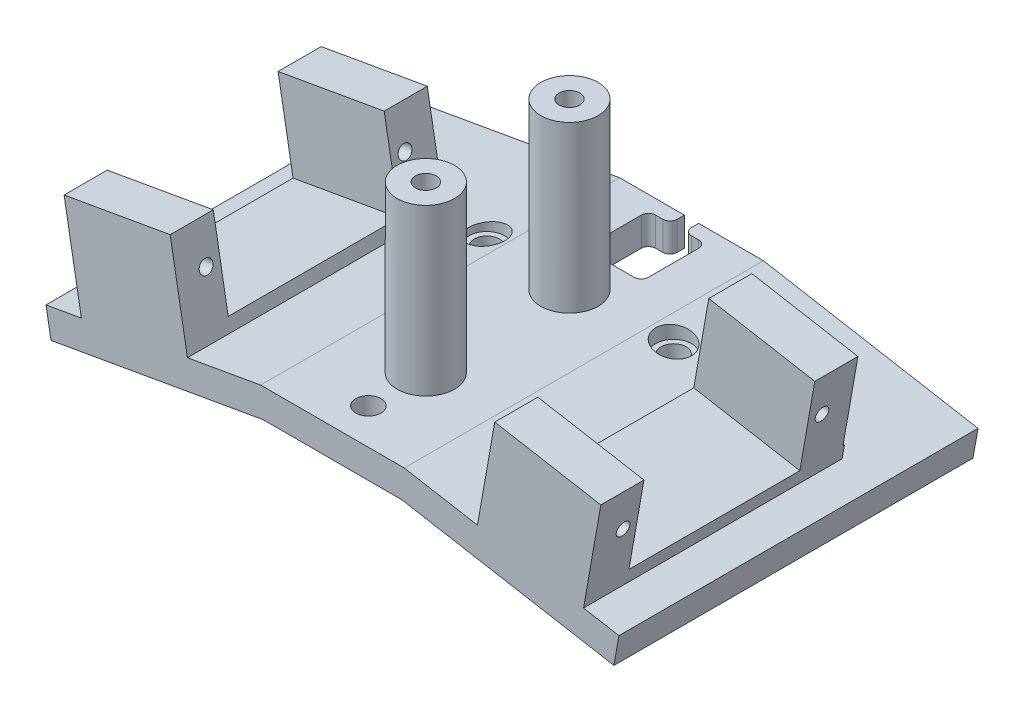
from build123d import *

# Parameters (mm, degrees)
EXTRUDE_1_DEPTH     = 25
EXTRUDE_2_DEPTH     = 36
SKETCH_3_W          = 15
SKETCH_3_H          = 6
EXTRUDE_3_DEPTH     = 12
SKETCH_4_R          = 0.95
CUT_EXTRUDE_1_DEPTH = 21
SKETCH_5_R          = 4
SKETCH_5_R_2        = 1.45
EXTRUDE_4_DEPTH     = 23
SKETCH_6_R          = 1.75
CUT_EXTRUDE_2_DEPTH = 20
SKETCH_7_R          = 2.5
CUT_EXTRUDE_3_DEPTH = 2
CUT_EXTRUDE_4_DEPTH = 53.393911874
FILLET_4_R          = 1


with BuildPart() as part:
    # 草图1 → 凸台-拉伸1 (new, symmetric)
    with BuildSketch(Plane.XY):
        Polygon((0, 0), (9.650045346, 0), (39.194277936, -5.20944533), (39.888870647, -1.270214318), (10, 4), (0, 4), align=None)
    extrude_1 = extrude(amount=EXTRUDE_1_DEPTH, both=True)

    # 草图2 → 凸台-拉伸2 (add)
    with BuildSketch(Plane.XY.offset(25)):
        Polygon((20.192715587, 2.202749235), (20.513964715, 4.024643578), (35.286081011, 1.419920913), (34.964831882, -0.40197343), align=None)
    extrude_2 = extrude(amount=-EXTRUDE_2_DEPTH)

    # 草图3 → 凸台-拉伸3 (add)
    with BuildSketch(Plane(origin=(1.306826311, 7.411380301, 0), x_dir=(0.9848077530122079, -0.1736481776669312, 0), z_dir=(0.1736481776669312, 0.9848077530122079, 0))):
        with Locations((27.003439474, -22)):
            Rectangle(SKETCH_3_W, SKETCH_3_H)
        with Locations((27.003439474, 7.8)):
            Rectangle(SKETCH_3_W, SKETCH_3_H)
    extrude_3 = extrude(amount=EXTRUDE_3_DEPTH)

    # 草图4 → 切除-拉伸1 (cut)
    with BuildSketch(Plane(origin=(33.979254699, -5.991459388, 0), x_dir=(0, 0, -1), z_dir=(0.9848077530122081, -0.17364817766693072, 0))):
        with Locations(Location((-20.95, 14.025712789, 0), (0, 0, 90))):
            Circle(SKETCH_4_R)
        with Locations(Location((6.75, 14.025712789, 0), (0, 0, 90))):
            Circle(SKETCH_4_R)
    cut_extrude_1 = extrude(amount=-CUT_EXTRUDE_1_DEPTH, mode=Mode.SUBTRACT)

    # 镜向1: 凸台-拉伸1, 凸台-拉伸2, 凸台-拉伸3, 切除-拉伸1 across plane
    add(extrude_1.mirror(Plane(origin=(0, 0, 0), x_dir=(0, 0, 1), z_dir=(1, 0, 0))))
    add(extrude_2.mirror(Plane(origin=(0, 0, 0), x_dir=(0, 0, 1), z_dir=(1, 0, 0))))
    add(extrude_3.mirror(Plane(origin=(0, 0, 0), x_dir=(0, 0, 1), z_dir=(1, 0, 0))))
    add(cut_extrude_1.mirror(Plane(origin=(0, 0, 0), x_dir=(0, 0, 1), z_dir=(1, 0, 0))), mode=Mode.SUBTRACT)

    # 草图5 → 凸台-拉伸4 (add)
    # profile 1 of 2: a face of its own
    with BuildSketch(Plane(origin=(0, 4, 0), x_dir=(1, 0, 0), z_dir=(0, 1, 0))):
        with Locations((0, -12)):
            Circle(SKETCH_5_R)
        with Locations(Location((0, -12, 0), (0, 0, 180))):
            Circle(SKETCH_5_R_2, mode=Mode.SUBTRACT)
    # profile 2 of 2: a face of its own
    with BuildSketch(Plane(origin=(0, 4, 0), x_dir=(1, 0, 0), z_dir=(0, 1, 0))):
        with Locations((0, 8)):
            Circle(SKETCH_5_R)
        with Locations(Location((0, 8, 0), (0, 0, 180))):
            Circle(SKETCH_5_R_2, mode=Mode.SUBTRACT)
    extrude(amount=EXTRUDE_4_DEPTH)

    # 草图6 → 切除-拉伸2 (cut)
    with BuildSketch(Plane(origin=(0, 4, 0), x_dir=(1, 0, 0), z_dir=(0, 1, 0))):
        with Locations(Location((0, -20, 0), (0, 0, 180))):
            Circle(SKETCH_6_R)
        with Locations((-13, 9.5)):
            Circle(SKETCH_6_R)
        with Locations(Location((13, 9.5, 0), (0, 0, 180))):
            Circle(SKETCH_6_R)
    extrude(amount=-CUT_EXTRUDE_2_DEPTH, mode=Mode.SUBTRACT)

    # 草图7 → 切除-拉伸3 (cut)
    with BuildSketch(Plane(origin=(0, 4, 0), x_dir=(1, 0, 0), z_dir=(0, 1, 0))):
        with Locations(Location((-13, 9.5, 0), (0, 0, 180))):
            Circle(SKETCH_7_R)
        with Locations(Location((13, 9.5, 0), (0, 0, 180))):
            Circle(SKETCH_7_R)
    extrude(amount=-CUT_EXTRUDE_3_DEPTH, mode=Mode.SUBTRACT)

    # 草图8 → 切除-拉伸4 (cut, through all)
    with BuildSketch(Plane(origin=(0, 4, 0), x_dir=(1, 0, 0), z_dir=(0, 1, 0))):
        Polygon((-4, 23), (-1, 23), (-1, 25), (1, 25), (1, 23), (4, 23), (4, 14), (-4, 14), align=None)
    extrude(amount=-CUT_EXTRUDE_4_DEPTH, mode=Mode.SUBTRACT)

    # 圆角4
    fillet_4_edges = [part.edges().sort_by_distance(p)[0] for p in [
        (4, 2, -23),
        (4, 2, -14),
        (-4, 2, -14),
        (-4, 2, -23),
        (1, 2, -23),
        (-1, 2, -23),
    ]]
    fillet(fillet_4_edges, radius=FILLET_4_R)


solid = part.part
